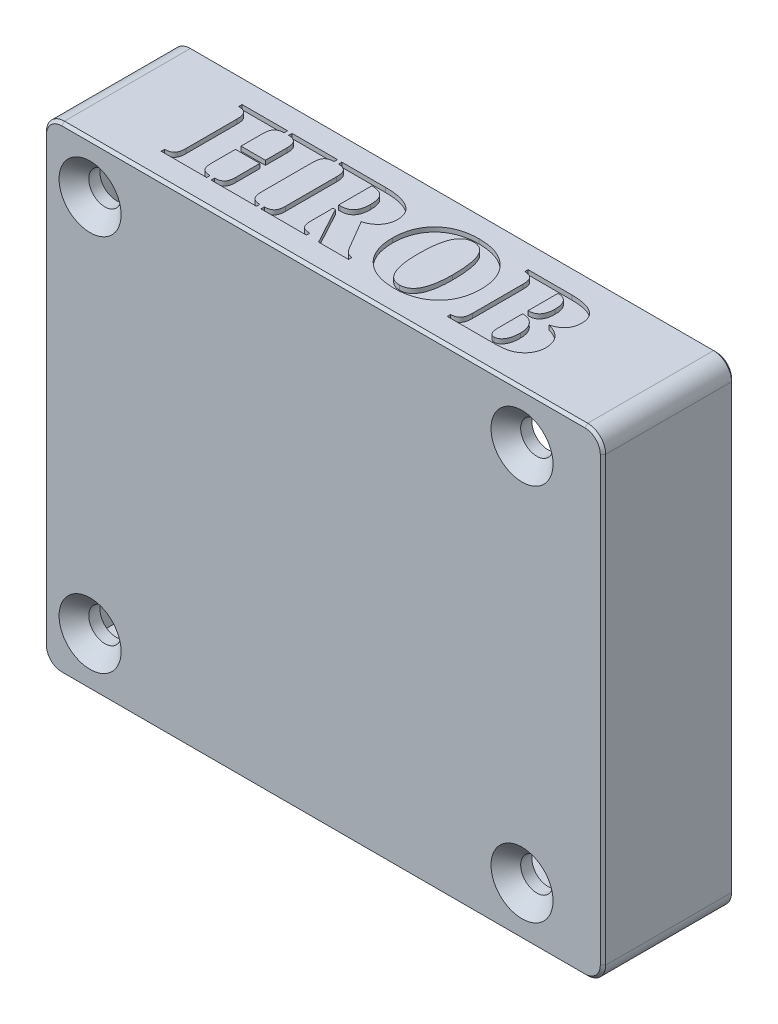
from build123d import *

# Parameters (mm, degrees)
SKIZZE1_W                                            = 62.2
SKIZZE1_H                                            = 53.2
SKIZZE1_W_2                                          = 58.5
SKIZZE1_H_2                                          = 49.5
AUFSATZ_LINEAR_AUSTRAGEN1_DEPTH                      = 13.2
SKIZZE2_W                                            = 62.2
SKIZZE2_H                                            = 53.2
AUFSATZ_LINEAR_AUSTRAGEN2_DEPTH                      = 1.4
SKIZZE3_W                                            = 12
SKIZZE3_H                                            = 10
AUFSATZ_LINEAR_AUSTRAGEN3_DEPTH                      = 1.5
SKIZZE4_R                                            = 1.65
SCHNITT_LINEAR_AUSTRAGEN1_DEPTH                      = 81.098907608
VERRUNDUNG1_R                                        = 2
FASE3_SIZE                                           = 0.3
FORMSENKUNG_F_R_M3_SENKSCHRAUBE_MIT_SCHL_D           = 3.6
FORMSENKUNG_F_R_M3_SENKSCHRAUBE_MIT_SCHL_CSINK_D     = 6.9
FORMSENKUNG_F_R_M3_SENKSCHRAUBE_MIT_SCHL_CSINK_ANGLE = 90
SCHNITT_LINEAR_AUSTRAGEN2_DEPTH                      = 0.5


with BuildPart() as part:
    # Skizze1 → Aufsatz-Linear austragen1 (new body)
    with BuildSketch(Plane.XY):
        with Locations((29.25, 24.75)):
            Rectangle(SKIZZE1_W, SKIZZE1_H)
        with Locations((29.25, 24.75)):
            Rectangle(SKIZZE1_W_2, SKIZZE1_H_2, mode=Mode.SUBTRACT)
    extrude(amount=AUFSATZ_LINEAR_AUSTRAGEN1_DEPTH)

    # Skizze2 → Aufsatz-Linear austragen2 (add)
    with BuildSketch(Plane.XY.offset(13.2)):
        with Locations((29.25, 24.75)):
            Rectangle(SKIZZE2_W, SKIZZE2_H)
    extrude(amount=AUFSATZ_LINEAR_AUSTRAGEN2_DEPTH)

    # Skizze3 → Aufsatz-Linear austragen3 (add)
    with BuildSketch(Plane(origin=(0, 0, 13.2), x_dir=(-1, 0, 0), z_dir=(0, 0, -1))):
        with Locations((-52.5, 44.5)):
            Rectangle(SKIZZE3_W, SKIZZE3_H)
        with Locations((-6, 44.5)):
            Rectangle(SKIZZE3_W, SKIZZE3_H)
        with Locations((-6, 5)):
            Rectangle(SKIZZE3_W, SKIZZE3_H)
        with Locations((-52.5, 5)):
            Rectangle(SKIZZE3_W, SKIZZE3_H)
    extrude(amount=AUFSATZ_LINEAR_AUSTRAGEN3_DEPTH)

    # Skizze4 → Schnitt-Linear austragen1 (cut, through all)
    with BuildSketch(Plane(origin=(0, 0, 11.7), x_dir=(-1, 0, 0), z_dir=(0, 0, -1))):
        with Locations((-51.34447199, 45.785)):
            Circle(SKIZZE4_R)
        with Locations((-3.30447199, 45.785)):
            Circle(SKIZZE4_R)
        with Locations((-3.30447199, 3.715)):
            Circle(SKIZZE4_R)
        with Locations((-51.34447199, 3.715)):
            Circle(SKIZZE4_R)
    extrude(amount=-SCHNITT_LINEAR_AUSTRAGEN1_DEPTH, mode=Mode.SUBTRACT)

    # Verrundung1
    verrundung1_edges = [part.edges().sort_by_distance(p)[0] for p in [
        (-1.85, 51.35, 7.3),
        (60.35, 51.35, 7.3),
        (60.35, -1.85, 7.3),
        (-1.85, -1.85, 7.3),
    ]]
    fillet(verrundung1_edges, radius=VERRUNDUNG1_R)

    # Fase3
    fase3_edges = [part.edges().sort_by_distance(p)[0] for p in [
        (29.25, 51.35, 0),
        (29.25, 51.35, 14.6),
        (-1.85, 24.75, 0),
        (60.35, 24.75, 0),
        (29.25, -1.85, 0),
        (59.764213562, -1.264213562, 0),
        (-1.264213562, -1.264213562, 0),
        (-1.264213562, 50.764213562, 0),
        (59.764213562, 50.764213562, 0),
        (60.35, 24.75, 14.6),
        (-1.85, 24.75, 14.6),
        (29.25, -1.85, 14.6),
        (59.764213562, -1.264213562, 14.6),
        (-1.264213562, -1.264213562, 14.6),
        (-1.264213562, 50.764213562, 14.6),
        (59.764213562, 50.764213562, 14.6),
    ]]
    chamfer(fase3_edges, length=FASE3_SIZE)

    # Formsenkung für M3 Senkschraube mit Schlitz/Kreuzschlitz2 (through all)
    with Locations(Plane.XY.offset(14.6)):
        with Locations((3.30447199, 3.715), (3.30447199, 45.785), (51.34447199, 45.785), (51.34447199, 3.715)):
            CounterSinkHole(FORMSENKUNG_F_R_M3_SENKSCHRAUBE_MIT_SCHL_D / 2, FORMSENKUNG_F_R_M3_SENKSCHRAUBE_MIT_SCHL_CSINK_D / 2, counter_sink_angle=FORMSENKUNG_F_R_M3_SENKSCHRAUBE_MIT_SCHL_CSINK_ANGLE)

    # Skizze5 → Schnitt-Linear austragen2 (cut)
    # profile 1 of 4: a face of its own
    with BuildSketch(Plane(origin=(0, 51.35, 0), x_dir=(1, 0, 0), z_dir=(0, 1, 0))):
        with BuildLine():
            add(Edge.make_bspline(
                [(12.379680279, -10.170431971), (12.380372468, -10.225033559), (12.38170966, -10.330514577), (12.393200832, -10.482336464), (12.412194937, -10.622017525), (12.438940163, -10.74959244), (12.473031524, -10.86521782), (12.515098179, -10.968215614), (12.565751183, -11.05805875), (12.643444134, -11.163115641), (12.774356036, -11.272231396), (12.973146247, -11.365702503), (13.216170534, -11.428427105), (13.393824836, -11.44341546), (13.48926932, -11.45146793)],
                knots=[0, 0, 0, 0, 1.004283559, 1.940105676, 2.798721019, 3.5956477, 4.335562544, 5.013380556, 5.637510397, 6.228101969, 7.40934417, 8.724707088, 10.240354241, 12, 12, 12, 12], degree=3))
            Line((13.48926932, -11.45146793), (13.48926932, -11.821330943))
            Line((13.48926932, -11.821330943), (8.434474799, -11.821330943))
            Line((8.434474799, -11.821330943), (8.434474799, -11.45146793))
            add(Edge.make_bspline(
                [(8.434474799, -11.45146793), (8.528593414, -11.445439824), (8.703487826, -11.434238193), (8.944463592, -11.375244541), (9.14266373, -11.281463142), (9.274135593, -11.170594243), (9.354465249, -11.064416682), (9.404237053, -10.971484929), (9.44916617, -10.868198703), (9.482143118, -10.751184641), (9.512517918, -10.623649484), (9.530143984, -10.482900792), (9.54213265, -10.330534261), (9.543405143, -10.225040273), (9.54406384, -10.170431971)],
                knots=[0, 0, 0, 0, 1.729959608, 3.214669802, 4.528151187, 5.724334436, 6.330598708, 6.964130593, 7.656423977, 8.395280426, 9.193598045, 10.062669507, 10.997152997, 12, 12, 12, 12], degree=3))
            Line((9.54406384, -10.170431971), (9.54406384, -4.504978204))
            add(Edge.make_bspline(
                [(9.54406384, -4.504978204), (9.543407625, -4.449085538), (9.542138939, -4.341026087), (9.530090209, -4.184823921), (9.512711892, -4.040831391), (9.482104316, -3.910768291), (9.44919679, -3.791817308), (9.404108983, -3.686723327), (9.35507967, -3.591990807), (9.273178658, -3.485307595), (9.143846362, -3.370398431), (8.944217354, -3.275653133), (8.703963558, -3.211787741), (8.528685353, -3.198393336), (8.434474799, -3.191193957)],
                knots=[0, 0, 0, 0, 1.014291002, 1.960968025, 2.842861928, 3.643107691, 4.384397207, 5.079241198, 5.715504282, 6.314598325, 7.511935767, 8.815053338, 10.288118099, 12, 12, 12, 12], degree=3))
            Line((8.434474799, -3.191193957), (8.434474799, -2.821330943))
            Line((8.434474799, -2.821330943), (13.48926932, -2.821330943))
            Line((13.48926932, -2.821330943), (13.48926932, -3.191193957))
            add(Edge.make_bspline(
                [(13.48926932, -3.191193957), (13.394512417, -3.199341227), (13.218208646, -3.214499959), (12.975357302, -3.276318145), (12.777682444, -3.375167148), (12.645590798, -3.486337479), (12.566986587, -3.594609596), (12.518015441, -3.688094135), (12.472384988, -3.79233532), (12.438908339, -3.911111866), (12.412194187, -4.041843538), (12.393223269, -4.185387095), (12.381712159, -4.34104614), (12.380372964, -4.449092375), (12.379680279, -4.504978204)],
                knots=[0, 0, 0, 0, 1.724565566, 3.20870988, 4.516927488, 5.706441771, 6.298509632, 6.934697842, 7.618723036, 8.359925317, 9.169023087, 10.039262737, 10.985828357, 12, 12, 12, 12], degree=3))
            Line((12.379680279, -4.504978204), (12.379680279, -6.889824094))
            Line((12.379680279, -6.889824094), (15.092009046, -6.889824094))
            Line((15.092009046, -6.889824094), (15.092009046, -4.504978204))
            add(Edge.make_bspline(
                [(15.092009046, -4.504978204), (15.091308078, -4.449095192), (15.089952869, -4.341054403), (15.078552738, -4.185357615), (15.05920728, -4.041941435), (15.033704177, -3.910602533), (14.996107891, -3.793288711), (14.954700799, -3.68700683), (14.902330171, -3.595167609), (14.82469547, -3.486690166), (14.693823774, -3.374569432), (14.496251715, -3.276439211), (14.253505813, -3.214462068), (14.077185694, -3.199327981), (13.982420005, -3.191193957)],
                knots=[0, 0, 0, 0, 1.014529647, 1.961429406, 2.831976253, 3.641359634, 4.386206963, 5.065989842, 5.708037062, 6.300313923, 7.48147803, 8.790157441, 10.27482566, 12, 12, 12, 12], degree=3))
            Line((13.982420005, -3.191193957), (13.982420005, -2.821330943))
            Line((13.982420005, -2.821330943), (19.037214525, -2.821330943))
            Line((19.037214525, -2.821330943), (19.037214525, -3.198899436))
            add(Edge.make_bspline(
                [(19.037214525, -3.198899436), (18.943000853, -3.204640024), (18.767769216, -3.215317164), (18.527781723, -3.277837797), (18.327388665, -3.370137931), (18.198539117, -3.485361527), (18.116603928, -3.591979952), (18.067582073, -3.686726608), (18.022492019, -3.791816331), (17.989585162, -3.910768583), (17.958977385, -4.040831301), (17.941599129, -4.184823948), (17.929550381, -4.341026079), (17.928281698, -4.449085536), (17.927625484, -4.504978204)],
                knots=[0, 0, 0, 0, 1.711004263, 3.182362714, 4.481452148, 5.679843499, 6.279464871, 6.916288001, 7.611743601, 8.353685607, 9.154635755, 10.03730591, 10.984816208, 12, 12, 12, 12], degree=3))
            Line((17.927625484, -4.504978204), (17.927625484, -10.170431971))
            add(Edge.make_bspline(
                [(17.927625484, -10.170431971), (17.928384691, -10.225022572), (17.929851351, -10.330482365), (17.940497556, -10.483177751), (17.962710927, -10.623072066), (17.987918105, -10.751983929), (18.025905758, -10.867196418), (18.066376516, -10.972607902), (18.119662441, -11.063783404), (18.19927195, -11.171331435), (18.332949225, -11.280730813), (18.53091536, -11.375415007), (18.770856233, -11.433852139), (18.944408151, -11.445330116), (19.037214525, -11.45146793)],
                knots=[0, 0, 0, 0, 1.003735382, 1.939046691, 2.810568727, 3.607060415, 4.350049686, 5.038415953, 5.678306975, 6.28510831, 7.491338991, 8.805983933, 10.292009368, 12, 12, 12, 12], degree=3))
            Line((19.037214525, -11.45146793), (19.037214525, -11.821330943))
            Line((19.037214525, -11.821330943), (13.982420005, -11.821330943))
            Line((13.982420005, -11.821330943), (13.982420005, -11.45146793))
            add(Edge.make_bspline(
                [(13.982420005, -11.45146793), (14.077864488, -11.44341546), (14.25551879, -11.428427105), (14.498543077, -11.365702503), (14.697333288, -11.272231396), (14.82824519, -11.163115641), (14.905938141, -11.05805875), (14.956591146, -10.968215614), (14.998657801, -10.86521782), (15.032749161, -10.74959244), (15.059494388, -10.622017525), (15.078488492, -10.482336464), (15.089979664, -10.330514577), (15.091316857, -10.225033559), (15.092009046, -10.170431971)],
                knots=[0, 0, 0, 0, 1.759645759, 3.275292912, 4.59065583, 5.771898031, 6.362489603, 6.986619444, 7.664437456, 8.4043523, 9.201278981, 10.059894324, 10.995716441, 12, 12, 12, 12], degree=3))
            Line((15.092009046, -10.170431971), (15.092009046, -7.50626245))
            Line((15.092009046, -7.50626245), (12.379680279, -7.50626245))
            Line((12.379680279, -7.50626245), (12.379680279, -10.170431971))
        make_face()
    # profile 2 of 4: a face of its own
    with BuildSketch(Plane(origin=(0, 51.35, 0), x_dir=(1, 0, 0), z_dir=(0, 1, 0))):
        with BuildLine():
            add(Edge.make_bspline(
                [(23.47557069, -10.18199019), (23.476226652, -10.23851942), (23.477480464, -10.346569888), (23.489233342, -10.502221811), (23.507992886, -10.644475928), (23.534409863, -10.774107956), (23.569397564, -10.88983881), (23.60927676, -10.993945241), (23.658638709, -11.084497605), (23.718444868, -11.161779451), (23.786557058, -11.228874779), (23.867791886, -11.284371761), (23.95796915, -11.335191298), (24.061126866, -11.375491601), (24.176521903, -11.405234332), (24.302376151, -11.430831131), (24.440366214, -11.445611176), (24.535685806, -11.449466759), (24.585159731, -11.45146793)],
                knots=[0, 0, 0, 0, 1.379907462, 2.637567249, 3.808188866, 4.881214148, 5.863232619, 6.756943072, 7.598974043, 8.37032594, 9.135279121, 9.922556364, 10.764587335, 11.658297788, 12.616631368, 13.671174746, 14.791265031, 16, 16, 16, 16], degree=3))
            Line((24.585159731, -11.45146793), (24.59286521, -11.821330943))
            Line((24.59286521, -11.821330943), (19.53036521, -11.821330943))
            Line((19.53036521, -11.821330943), (19.53036521, -11.45146793))
            add(Edge.make_bspline(
                [(19.53036521, -11.45146793), (19.624527066, -11.445516813), (19.799501832, -11.434458245), (20.039686487, -11.374610815), (20.239292895, -11.283938431), (20.368904925, -11.172270263), (20.451006304, -11.068120253), (20.499518796, -10.975681298), (20.545578257, -10.873569119), (20.577648004, -10.757493612), (20.608497491, -10.631400305), (20.626017221, -10.492530499), (20.638083605, -10.341457167), (20.639313642, -10.236600236), (20.639954251, -10.18199019)],
                knots=[0, 0, 0, 0, 1.738695277, 3.230902719, 4.545843641, 5.748067182, 6.347979624, 6.984710615, 7.669609164, 8.412196569, 9.202990059, 10.064706709, 10.992088983, 12, 12, 12, 12], degree=3))
            Line((20.639954251, -10.18199019), (20.639954251, -4.537726491))
            add(Edge.make_bspline(
                [(20.639954251, -4.537726491), (20.639300531, -4.479908855), (20.638042512, -4.368644566), (20.626123084, -4.208573156), (20.608388783, -4.061437526), (20.577914709, -3.928162931), (20.545444177, -3.805875298), (20.499949383, -3.698342416), (20.450997365, -3.601696542), (20.369161948, -3.492584406), (20.240644407, -3.374128812), (20.040213701, -3.277740002), (19.800180812, -3.211205071), (19.624630614, -3.198185235), (19.53036521, -3.191193957)],
                knots=[0, 0, 0, 0, 1.034661009, 1.991102165, 2.872129252, 3.683696484, 4.436755151, 5.132556645, 5.77010351, 6.370076391, 7.566107687, 8.856289373, 10.311917869, 12, 12, 12, 12], degree=3))
            Line((19.53036521, -3.191193957), (19.53036521, -2.821330943))
            Line((19.53036521, -2.821330943), (24.398301854, -2.821330943))
            add(Edge.make_bspline(
                [(24.398301854, -2.821330943), (24.546686163, -2.823057222), (24.83540238, -2.826416099), (25.254581762, -2.855831541), (25.64672565, -2.901963512), (26.01035307, -2.972922718), (26.348256753, -3.056760787), (26.657354128, -3.166139527), (26.941265045, -3.289912645), (27.195708959, -3.436894571), (27.423804311, -3.60062535), (27.62064076, -3.784255766), (27.789659934, -3.98423619), (27.924705777, -4.204414961), (28.031987339, -4.441010205), (28.107127072, -4.696381499), (28.151582603, -4.968957536), (28.157486209, -5.156565848), (28.160502196, -5.25240971)],
                knots=[0, 0, 0, 0, 1.410179415, 2.743832334, 3.992150744, 5.160407799, 6.263221803, 7.29782505, 8.273218036, 9.202836352, 10.085467463, 10.936186015, 11.755135742, 12.566408075, 13.383171624, 14.217375808, 15.089306935, 16, 16, 16, 16], degree=3))
            add(Edge.make_bspline(
                [(28.160502196, -5.25240971), (28.159107554, -5.317984315), (28.156350428, -5.447621469), (28.131818641, -5.638766179), (28.096215351, -5.823950808), (28.044090263, -6.00292007), (27.974180453, -6.173836131), (27.890635421, -6.338489055), (27.794238384, -6.498005665), (27.68089951, -6.649254983), (27.55311088, -6.790758958), (27.417213883, -6.925686244), (27.2649958, -7.04448829), (27.102818642, -7.154493642), (26.92989179, -7.255575886), (26.743209967, -7.341145084), (26.546959154, -7.419558047), (26.409793178, -7.460441732), (26.340082676, -7.481219642)],
                knots=[0, 0, 0, 0, 1.012231676, 2.001122752, 2.971545141, 3.922313443, 4.874322013, 5.818916598, 6.771286608, 7.749027711, 8.732284602, 9.714040261, 10.70208577, 11.708716217, 12.739430637, 13.790783588, 14.87723187, 16, 16, 16, 16], degree=3))
            Line((26.340082676, -7.481219642), (28.147017607, -10.555705943))
            add(Edge.make_bspline(
                [(28.147017607, -10.555705943), (28.192298043, -10.632705775), (28.276864381, -10.776511676), (28.408817502, -10.968666673), (28.537698435, -11.121499777), (28.666420316, -11.238060251), (28.800867477, -11.325432615), (28.946644998, -11.384853583), (29.103212993, -11.431945804), (29.213247961, -11.444818162), (29.270091237, -11.45146793)],
                knots=[0, 0, 0, 0, 1.420973479, 2.653828814, 3.704340097, 4.594348038, 5.40769851, 6.240765204, 7.091191902, 8, 8, 8, 8], degree=3))
            Line((29.270091237, -11.45146793), (29.270091237, -11.821330943))
            Line((29.270091237, -11.821330943), (25.935545005, -11.821330943))
            Line((25.935545005, -11.821330943), (23.737556991, -7.752837793))
            Line((23.737556991, -7.752837793), (23.47557069, -7.752837793))
            Line((23.47557069, -7.752837793), (23.47557069, -10.18199019))
        make_face()
        with BuildLine():
            Line((23.47557069, -7.136399436), (23.633533018, -7.136399436))
            add(Edge.make_bspline(
                [(23.633533018, -7.136399436), (23.697807951, -7.134887353), (23.822227156, -7.131960362), (24.002677748, -7.110369803), (24.170390456, -7.076175479), (24.326040268, -7.028786026), (24.467725889, -6.964103314), (24.597495525, -6.88731859), (24.714783526, -6.796105527), (24.81778401, -6.688483925), (24.907933576, -6.566273062), (24.988842148, -6.430280526), (25.052034764, -6.276854776), (25.109704327, -6.110288266), (25.150960291, -5.927387247), (25.178621032, -5.728864578), (25.199203312, -5.516103777), (25.200784695, -5.368687682), (25.201598087, -5.292863477)],
                knots=[0, 0, 0, 0, 1.109138892, 2.146998411, 3.131598403, 4.060483383, 4.948331407, 5.813123606, 6.657798264, 7.50428857, 8.375377968, 9.274429782, 10.227591488, 11.233418533, 12.314121142, 13.456696833, 14.691839309, 16, 16, 16, 16], degree=3))
            add(Edge.make_bspline(
                [(25.201598087, -5.292863477), (25.200702886, -5.213843386), (25.198975049, -5.061325787), (25.17978708, -4.841123842), (25.146871973, -4.637810655), (25.103389154, -4.451469539), (25.048089115, -4.280930841), (24.976459076, -4.128894821), (24.893615588, -3.99282697), (24.798168641, -3.872596631), (24.686483894, -3.769657007), (24.560140176, -3.680451453), (24.41824576, -3.605246483), (24.26058465, -3.543288104), (24.086744495, -3.496010214), (23.897374067, -3.461043592), (23.69167587, -3.442867354), (23.549445927, -3.439512062), (23.47557069, -3.437769299)],
                knots=[0, 0, 0, 0, 1.291065692, 2.49190093, 3.608049938, 4.654126776, 5.616430327, 6.531820864, 7.39387354, 8.214906804, 9.031637211, 9.867226697, 10.735705806, 11.649591508, 12.629751131, 13.675301536, 14.792535189, 16, 16, 16, 16], degree=3))
            Line((23.47557069, -3.437769299), (23.47557069, -7.136399436))
        make_face(mode=Mode.SUBTRACT)
    # profile 3 of 4: a face of its own
    with BuildSketch(Plane(origin=(0, 51.35, 0), x_dir=(1, 0, 0), z_dir=(0, 1, 0))):
        with BuildLine():
            add(Edge.make_bspline(
                [(39.50296795, -7.321330943), (39.498824479, -7.498073668), (39.490722196, -7.843682341), (39.429642088, -8.348494157), (39.322000158, -8.824319475), (39.179812936, -9.274586491), (38.98854989, -9.694657325), (38.758663415, -10.08869957), (38.485573648, -10.454662251), (38.171442656, -10.789164076), (37.822379071, -11.08949555), (37.443858936, -11.353660449), (37.033695439, -11.57330131), (36.595985696, -11.755779865), (36.128349687, -11.895682965), (35.631738506, -11.994708778), (35.106731415, -12.058595454), (34.746310926, -12.064754017), (34.561829251, -12.067906286)],
                knots=[0, 0, 0, 0, 1.095713296, 2.142594663, 3.146156418, 4.11686609, 5.064808163, 6.001624253, 6.94040092, 7.889612909, 8.840926551, 9.790697767, 10.745503884, 11.719986259, 12.726323906, 13.766331688, 14.856694102, 16, 16, 16, 16], degree=3))
            add(Edge.make_bspline(
                [(34.561829251, -12.067906286), (34.377986397, -12.064768636), (34.018839671, -12.058639072), (33.495162109, -11.994484892), (32.999733138, -11.895955996), (32.533374816, -11.755838586), (32.097275167, -11.572763545), (31.687770625, -11.354230299), (31.310901203, -11.089384197), (30.963717968, -10.789133071), (30.651487142, -10.454607109), (30.380443952, -10.088597919), (30.152078142, -9.694679485), (29.964214531, -9.273711547), (29.81764375, -8.825060053), (29.714184521, -8.348124843), (29.651952824, -7.843744367), (29.644014086, -7.498094655), (29.639954251, -7.321330943)],
                knots=[0, 0, 0, 0, 1.141471567, 2.229924992, 3.271890306, 4.276304011, 5.24893893, 6.205542211, 7.153826754, 8.103913173, 9.052189327, 9.990353328, 10.926921868, 11.87501345, 12.848784554, 13.853372483, 14.902224321, 16, 16, 16, 16], degree=3))
            add(Edge.make_bspline(
                [(29.639954251, -7.321330943), (29.644025254, -7.143929196), (29.651986388, -6.79700749), (29.714073482, -6.290662792), (29.817883007, -5.812773623), (29.962215093, -5.362342012), (30.149867498, -4.940799286), (30.377934644, -4.546567388), (30.649669128, -4.18283515), (30.960506958, -3.849097249), (31.306471917, -3.549219277), (31.684545703, -3.286752048), (32.093383318, -3.068001201), (32.529192279, -2.884405463), (32.996838746, -2.747036802), (33.492586652, -2.648225377), (34.017558051, -2.583952695), (34.377345196, -2.577873012), (34.561829251, -2.574755601)],
                knots=[0, 0, 0, 0, 1.101081274, 2.153242558, 3.161104426, 4.133040994, 5.084188077, 6.020178614, 6.954563452, 7.896620568, 8.846120641, 9.791545264, 10.747558178, 11.719592836, 12.72223832, 13.767467371, 14.855249057, 16, 16, 16, 16], degree=3))
            add(Edge.make_bspline(
                [(34.561829251, -2.574755601), (34.746952141, -2.57788771), (35.108013084, -2.583996529), (35.63431361, -2.648001851), (36.131246276, -2.747307712), (36.600167048, -2.884463232), (37.037587879, -3.067462312), (37.447085228, -3.287322925), (37.826812961, -3.549102477), (38.174631412, -3.84907706), (38.487464034, -4.182753285), (38.76091886, -4.546563091), (38.99158592, -4.940213367), (39.178118373, -5.362792978), (39.325687176, -5.812346777), (39.428653057, -6.290728676), (39.490988307, -6.796989814), (39.498914708, -7.143923215), (39.50296795, -7.321330943)],
                knots=[0, 0, 0, 0, 1.146578651, 2.236270028, 3.279537215, 4.284113689, 5.257996342, 6.212214847, 7.159138963, 8.109867142, 9.052871133, 9.987883992, 10.924123542, 11.873485348, 12.844828877, 13.850799017, 14.900985424, 16, 16, 16, 16], degree=3))
        make_face()
        with BuildLine():
            add(Edge.make_bspline(
                [(34.567608361, -11.45146793), (34.647457972, -11.448674965), (34.802800194, -11.443241434), (35.028579636, -11.395878471), (35.237666242, -11.315786152), (35.433822666, -11.207326642), (35.611389083, -11.064186176), (35.775318493, -10.892012329), (35.92356041, -10.688749425), (36.054277966, -10.453250526), (36.168910877, -10.187469354), (36.271326884, -9.892900725), (36.35428294, -9.567021022), (36.426179296, -9.213009744), (36.47876193, -8.828143892), (36.516767844, -8.413574826), (36.539967035, -7.968855621), (36.542670448, -7.662326988), (36.54406384, -7.50433608)],
                knots=[0, 0, 0, 0, 0.780563551, 1.518535573, 2.244213492, 2.964186458, 3.70194456, 4.466159418, 5.284098028, 6.156002943, 7.095526999, 8.112675584, 9.203614133, 10.38260413, 11.644997378, 13.001416932, 14.454471097, 16, 16, 16, 16], degree=3))
            add(Edge.make_bspline(
                [(36.54406384, -7.50433608), (36.542448102, -7.323883842), (36.539330443, -6.975691144), (36.519409407, -6.471829334), (36.480659244, -6.006024665), (36.428922635, -5.577390234), (36.365907041, -5.185692744), (36.282188262, -4.832258245), (36.187945622, -4.515202782), (36.076035663, -4.235124978), (35.948382702, -3.989351706), (35.804920823, -3.775390862), (35.640726291, -3.595631044), (35.460524528, -3.446904933), (35.261826936, -3.331960256), (35.045811411, -3.250603577), (34.812816544, -3.1983671), (34.650730012, -3.193625538), (34.567608361, -3.191193957)],
                knots=[0, 0, 0, 0, 1.642902529, 3.170072426, 4.589636339, 5.897019644, 7.100295179, 8.199256646, 9.201574811, 10.109123645, 10.940659326, 11.718972898, 12.447267918, 13.14940093, 13.838266413, 14.52661077, 15.244412575, 16, 16, 16, 16], degree=3))
            add(Edge.make_bspline(
                [(34.567608361, -3.191193957), (34.487077124, -3.19381972), (34.329624477, -3.198953544), (34.102386215, -3.248892902), (33.89067668, -3.32803853), (33.695607974, -3.441658577), (33.517300522, -3.588254133), (33.354715152, -3.765732991), (33.20726107, -3.973755784), (33.07872332, -4.215232546), (32.966159195, -4.488716346), (32.86504437, -4.794069675), (32.784921986, -5.134256308), (32.714475381, -5.506163705), (32.66464458, -5.912323265), (32.625903285, -6.351743466), (32.602981897, -6.825369701), (32.60026266, -7.15242782), (32.598858361, -7.321330943)],
                knots=[0, 0, 0, 0, 0.759884674, 1.485707397, 2.186532005, 2.887855337, 3.607950906, 4.359262797, 5.15547654, 6.010532106, 6.93779966, 7.946910653, 9.046049156, 10.23711036, 11.521596964, 12.91010815, 14.404282432, 16, 16, 16, 16], degree=3))
            add(Edge.make_bspline(
                [(32.598858361, -7.321330943), (32.600273526, -7.488949495), (32.603018541, -7.814081256), (32.625876136, -8.28514481), (32.664768284, -8.723263542), (32.714458757, -9.128796163), (32.784944818, -9.500691602), (32.864976604, -9.840914095), (32.966567197, -10.146713334), (33.078673494, -10.421636395), (33.207360633, -10.664896455), (33.35411104, -10.874807151), (33.51737974, -11.05238866), (33.695526739, -11.199259013), (33.891119717, -11.312190123), (34.101919413, -11.394342419), (34.329688784, -11.44354183), (34.487098885, -11.448785821), (34.567608361, -11.45146793)],
                knots=[0, 0, 0, 0, 1.584195899, 3.072884207, 4.455884781, 5.740866372, 6.932386562, 8.031948626, 9.041448489, 9.97467494, 10.835404273, 11.636880455, 12.388481871, 13.108854934, 13.810448527, 14.513720073, 15.239822498, 16, 16, 16, 16], degree=3))
        make_face(mode=Mode.SUBTRACT)
    # profile 4 of 4: a face of its own
    with BuildSketch(Plane(origin=(0, 51.35, 0), x_dir=(1, 0, 0), z_dir=(0, 1, 0))):
        with BuildLine():
            Line((40.242693977, -11.821330943), (40.242693977, -11.45146793))
            add(Edge.make_bspline(
                [(40.242693977, -11.45146793), (40.336882418, -11.444988829), (40.512177783, -11.432930488), (40.753370009, -11.369617283), (40.953081125, -11.270113069), (41.081866056, -11.15029755), (41.163930629, -11.038598496), (41.211246303, -10.939312499), (41.258307136, -10.830554479), (41.290095076, -10.706726052), (41.320954704, -10.570977133), (41.338167613, -10.421850176), (41.350472888, -10.259899071), (41.351661887, -10.147987094), (41.352283018, -10.089524436)],
                knots=[0, 0, 0, 0, 1.673615919, 3.114788907, 4.400055177, 5.594390238, 6.198862014, 6.851633369, 7.541968313, 8.300081415, 9.116419019, 10.013140572, 10.962067468, 12, 12, 12, 12], degree=3))
            Line((41.352283018, -10.089524436), (41.352283018, -4.483788135))
            add(Edge.make_bspline(
                [(41.352283018, -4.483788135), (41.351616513, -4.428538733), (41.350328429, -4.321764125), (41.338480133, -4.168099946), (41.320728534, -4.026718329), (41.290363592, -3.899183369), (41.257387497, -3.782165999), (41.212447442, -3.678891503), (41.16271404, -3.585920484), (41.081951102, -3.479589376), (40.951208595, -3.366941904), (40.752866139, -3.271253945), (40.51189242, -3.210203194), (40.336840393, -3.197842032), (40.242693977, -3.191193957)],
                knots=[0, 0, 0, 0, 1.011216638, 1.95427021, 2.820410553, 3.616035684, 4.352400189, 5.042358674, 5.673753844, 6.277973367, 7.477805595, 8.792071838, 10.274713289, 12, 12, 12, 12], degree=3))
            Line((40.242693977, -3.191193957), (40.242693977, -2.821330943))
            Line((40.242693977, -2.821330943), (45.141452539, -2.821330943))
            add(Edge.make_bspline(
                [(45.141452539, -2.821330943), (45.271861418, -2.82233832), (45.524635014, -2.824290933), (45.890384311, -2.852649359), (46.23141397, -2.893865984), (46.54765971, -2.952775154), (46.839054993, -3.030150785), (47.107125649, -3.120950278), (47.34831199, -3.233641915), (47.566457203, -3.360201851), (47.757948527, -3.505704199), (47.926257587, -3.665697976), (48.065757394, -3.845925248), (48.182559407, -4.040629714), (48.271421811, -4.253657231), (48.33518053, -4.481942143), (48.371479673, -4.727283463), (48.376893439, -4.895912779), (48.379680279, -4.98271793)],
                knots=[0, 0, 0, 0, 1.418979907, 2.750431241, 3.990013274, 5.156455105, 6.248146096, 7.269260755, 8.232306598, 9.140836585, 10.008842285, 10.844129889, 11.660581444, 12.481596633, 13.308421244, 14.164728563, 15.055259085, 16, 16, 16, 16], degree=3))
            add(Edge.make_bspline(
                [(48.379680279, -4.98271793), (48.378982329, -5.046363346), (48.377610464, -5.171462489), (48.354578108, -5.354762529), (48.323068218, -5.530226184), (48.276998014, -5.69679853), (48.215608825, -5.853805376), (48.146095651, -6.005085508), (48.058025948, -6.145098444), (47.959973635, -6.277641539), (47.846758951, -6.398667009), (47.7243154, -6.512850398), (47.587938362, -6.61584768), (47.43901834, -6.706819219), (47.280917044, -6.793602641), (47.108054758, -6.865830954), (46.923953537, -6.929415818), (46.79580531, -6.963201029), (46.730707676, -6.980363477)],
                knots=[0, 0, 0, 0, 1.07971528, 2.122249556, 3.131421468, 4.104747612, 5.050203799, 5.991313618, 6.926152046, 7.852754977, 8.786257693, 9.735164119, 10.692300373, 11.681431346, 12.695888455, 13.75083058, 14.857451158, 16, 16, 16, 16], degree=3))
            add(Edge.make_bspline(
                [(46.730707676, -6.980363477), (46.811292244, -7.001764408), (46.968841032, -7.043604808), (47.194708097, -7.123080523), (47.405820508, -7.213850216), (47.601773478, -7.315225379), (47.782867686, -7.427868126), (47.949094483, -7.551573422), (48.101361552, -7.685519639), (48.237283864, -7.831979631), (48.359070999, -7.987182084), (48.463212337, -8.154288877), (48.552162031, -8.329401611), (48.624392572, -8.515229165), (48.679306216, -8.710893714), (48.719703293, -8.916346764), (48.745853202, -9.130801995), (48.748297845, -9.277160862), (48.749543292, -9.351724779)],
                knots=[0, 0, 0, 0, 1.178468267, 2.303992561, 3.3816319, 4.425194863, 5.420242055, 6.39347264, 7.351725286, 8.283109756, 9.214715431, 10.13662727, 11.06233089, 11.987900947, 12.950615794, 13.931648712, 14.946258761, 16, 16, 16, 16], degree=3))
            add(Edge.make_bspline(
                [(48.749543292, -9.351724779), (48.745158166, -9.468290743), (48.736553559, -9.697019426), (48.667143425, -10.029277749), (48.554970369, -10.341971334), (48.395835878, -10.632072655), (48.19370532, -10.897390564), (47.951138098, -11.13691989), (47.668380484, -11.350985269), (47.456076412, -11.465773618), (47.347146032, -11.524669984)],
                knots=[0, 0, 0, 0, 1.022556324, 2.006485889, 2.965854624, 3.929519702, 4.899118522, 5.883677657, 6.914143315, 8, 8, 8, 8], degree=3))
            add(Edge.make_bspline(
                [(47.347146032, -11.524669984), (47.291023787, -11.549397432), (47.173734384, -11.601075116), (46.980905357, -11.662523768), (46.765154515, -11.710264366), (46.52581368, -11.754560949), (46.256625605, -11.783372846), (45.954098434, -11.806772084), (45.615450787, -11.819741842), (45.37776351, -11.820784463), (45.253181991, -11.821330943)],
                knots=[0, 0, 0, 0, 0.690523331, 1.443118843, 2.274812519, 3.17865105, 4.183559103, 5.322528911, 6.59662906, 8, 8, 8, 8], degree=3))
            Line((45.253181991, -11.821330943), (40.242693977, -11.821330943))
        make_face()
        with BuildLine():
            Line((44.187899457, -7.382974779), (44.187899457, -10.103009025))
            add(Edge.make_bspline(
                [(44.187899457, -10.103009025), (44.189259033, -10.189815593), (44.191807061, -10.352502699), (44.222775284, -10.579187067), (44.270180031, -10.7722142), (44.34119308, -10.93092927), (44.434937996, -11.054757223), (44.550474766, -11.143380832), (44.687822787, -11.195883563), (44.785891566, -11.20180266), (44.837086101, -11.204892587)],
                knots=[0, 0, 0, 0, 1.446381266, 2.710711761, 3.806608982, 4.750308893, 5.589804221, 6.369256064, 7.148707907, 8, 8, 8, 8], degree=3))
            add(Edge.make_bspline(
                [(44.837086101, -11.204892587), (44.877015614, -11.203490467), (44.955010505, -11.200751686), (45.069429239, -11.176732932), (45.17728843, -11.136459494), (45.278145297, -11.079108158), (45.374399278, -11.009287836), (45.463372592, -10.921246795), (45.545113789, -10.816723835), (45.650872909, -10.656212147), (45.75924475, -10.420358262), (45.850672188, -10.099592966), (45.903301765, -9.735500164), (45.910262252, -9.479041386), (45.913926854, -9.344019299)],
                knots=[0, 0, 0, 0, 0.603189135, 1.178218006, 1.758874554, 2.336927977, 2.927244016, 3.552002946, 4.22218271, 4.930383631, 6.454768908, 8.123107622, 9.958868465, 12, 12, 12, 12], degree=3))
            add(Edge.make_bspline(
                [(45.913926854, -9.344019299), (45.912346272, -9.271410122), (45.909248179, -9.1290892), (45.888058603, -8.921718841), (45.85311064, -8.725384226), (45.806202798, -8.540454997), (45.741853043, -8.366937858), (45.662368758, -8.205845181), (45.572266534, -8.053497025), (45.465735197, -7.91563088), (45.349296807, -7.789933647), (45.220847786, -7.682215051), (45.08534299, -7.587599534), (44.937981585, -7.512600308), (44.780579846, -7.454960375), (44.614212814, -7.41226836), (44.437837224, -7.386750251), (44.317051419, -7.384251695), (44.255322402, -7.382974779)],
                knots=[0, 0, 0, 0, 1.203973843, 2.359903694, 3.452293749, 4.50859137, 5.519307231, 6.514593136, 7.484259918, 8.449003312, 9.398166674, 10.319815704, 11.223576582, 12.133152302, 13.052892579, 13.998105815, 14.976908248, 16, 16, 16, 16], degree=3))
            Line((44.255322402, -7.382974779), (44.187899457, -7.382974779))
        make_face(mode=Mode.SUBTRACT)
        with BuildLine():
            Line((44.187899457, -6.766536423), (44.243764183, -6.766536423))
            add(Edge.make_bspline(
                [(44.243764183, -6.766536423), (44.295221806, -6.76582163), (44.396038861, -6.76442119), (44.541682801, -6.742017721), (44.678684333, -6.70960322), (44.80592544, -6.664081324), (44.922302219, -6.603215308), (45.03050216, -6.531316807), (45.127955752, -6.444782204), (45.21579479, -6.345074536), (45.293216835, -6.232446298), (45.359478631, -6.10715987), (45.418833435, -5.971201279), (45.463574707, -5.822160199), (45.501141879, -5.661488436), (45.524614339, -5.488613278), (45.54071625, -5.304081896), (45.542922979, -5.177319752), (45.54406384, -5.11178471)],
                knots=[0, 0, 0, 0, 1.030063449, 2.018125923, 2.944978531, 3.848587172, 4.717545355, 5.570446834, 6.445574987, 7.32070314, 8.227238456, 9.177114844, 10.157017282, 11.194766683, 12.290330914, 13.460356441, 14.687024037, 16, 16, 16, 16], degree=3))
            add(Edge.make_bspline(
                [(45.54406384, -5.11178471), (45.54284034, -5.044977957), (45.540472292, -4.915675497), (45.525561466, -4.72831177), (45.498510213, -4.553167985), (45.460590461, -4.390834216), (45.412099609, -4.239813997), (45.352664304, -4.101857264), (45.283766751, -3.974971496), (45.201500104, -3.86293307), (45.11125459, -3.761257491), (45.008269892, -3.67457436), (44.89578981, -3.600709245), (44.773423423, -3.540792767), (44.641512452, -3.494278025), (44.499216176, -3.462399957), (44.34722395, -3.439776544), (44.241927093, -3.438449965), (44.187899457, -3.437769299)],
                knots=[0, 0, 0, 0, 1.305548699, 2.526850204, 3.669764053, 4.765482688, 5.781339138, 6.76498794, 7.697357309, 8.595929826, 9.47546357, 10.347897297, 11.217981639, 12.099035753, 13.003894514, 13.94441875, 14.945284795, 16, 16, 16, 16], degree=3))
            Line((44.187899457, -3.437769299), (44.187899457, -6.766536423))
        make_face(mode=Mode.SUBTRACT)
    extrude(amount=-SCHNITT_LINEAR_AUSTRAGEN2_DEPTH, mode=Mode.SUBTRACT)


solid = part.part
